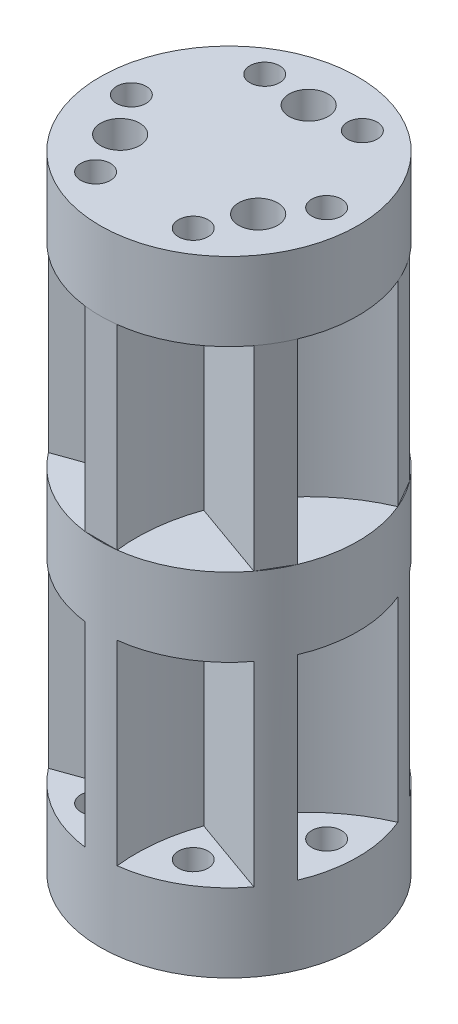
from build123d import *
from build123d.topology import SkipClean

# Parameters (mm, degrees)
SKETCH_1_R               = 16.5
EXTRUDE_1_DEPTH          = 10
CUT_EXTRUDE_1_DEPTH      = 26.38700455
CUT_EXTRUDE_1_DEPTH_BACK = 26.38700455
SKETCH_4_R               = 2.5
SKETCH_4_R_2             = 1.9
EXTRUDE_2_DEPTH          = 25
SKETCH_7_R               = 16.5
EXTRUDE_3_DEPTH          = 5
EXTRUDE_4_DEPTH          = 25
SKETCH_10_R              = 16.5
EXTRUDE_5_DEPTH          = 10
SKETCH_11_R              = 1.9
SKETCH_11_R_2            = 2.5
CUT_EXTRUDE_3_DEPTH      = 10


with BuildPart() as part:
    # 草图1 → 凸台-拉伸1 (new body)
    with BuildSketch(Plane(origin=(0, 0, 0), x_dir=(1, 0, 0), z_dir=(0, 1, 0))):
        with Locations(Location((0, 0, 0), (0, 0, 270))):
            Circle(SKETCH_1_R)
    extrude(amount=EXTRUDE_1_DEPTH)

    # 草图4 → 切除-拉伸1 (cut, two sides: drawn at the far end of the back side and taken through both)
    with BuildSketch(Plane(origin=(0, 10, 0), x_dir=(1, 0, 0), z_dir=(0, 1, 0)).offset(-CUT_EXTRUDE_1_DEPTH_BACK)):
        with Locations(Location((0, 10.2, 0), (0, 0, 270))):
            Circle(SKETCH_4_R)
        with Locations(Location((-6.25, 10.825317547, 0), (0, 0, 270))):
            Circle(SKETCH_4_R_2)
        with Locations(Location((6.25, 10.825317547, 0), (0, 0, 270))):
            Circle(SKETCH_4_R_2)
        with Locations(Location((12.5, 0, 0), (0, 0, 270))):
            Circle(SKETCH_4_R_2)
        with Locations(Location((6.25, -10.825317547, 0), (0, 0, 270))):
            Circle(SKETCH_4_R_2)
        with Locations(Location((-6.25, -10.825317547, 0), (0, 0, 270))):
            Circle(SKETCH_4_R_2)
        with Locations(Location((-12.5, 0, 0), (0, 0, 270))):
            Circle(SKETCH_4_R_2)
        with Locations(Location((8.833459119, -5.1, 0), (0, 0, 270))):
            Circle(SKETCH_4_R)
        with Locations(Location((-8.833459119, -5.1, 0), (0, 0, 270))):
            Circle(SKETCH_4_R)
    extrude(amount=CUT_EXTRUDE_1_DEPTH + CUT_EXTRUDE_1_DEPTH_BACK, mode=Mode.SUBTRACT)

    # 草图6 → 凸台-拉伸2 (add)
    with SkipClean():  # the faces are left unmerged after this step: merging them gives an invalid solid
        with BuildSketch(Plane(origin=(0, 10, 0), x_dir=(1, 0, 0), z_dir=(0, 1, 0))):
            with BuildLine():
                Line((-15.206199095, -6.404803594), (-7.145587151, 0.449076957))
                ThreePointArc((-7.145587151, 0.449076957), (-10.83223207, 3.892058734), (-15.206199095, 6.404803594))
                ThreePointArc((-15.206199095, 6.404803594), (-14.289419162, 8.25), (-13.149822167, 9.966552914))
                ThreePointArc((-13.149822167, 9.966552914), (-8.786737771, 7.434958785), (-3.961705629, 5.96372152))
                Line((-3.961705629, 5.96372152), (-2.056376928, 16.371356508))
                ThreePointArc((-2.056376928, 16.371356508), (0, 16.5), (2.056376928, 16.371356508))
                Line((2.056376928, 16.371356508), (3.961705629, 5.96372152))
                ThreePointArc((3.961705629, 5.96372152), (8.786737771, 7.434958785), (13.149822167, 9.966552914))
                ThreePointArc((13.149822167, 9.966552914), (14.289419162, 8.25), (15.206199095, 6.404803594))
                ThreePointArc((15.206199095, 6.404803594), (10.83223207, 3.892058734), (7.145587151, 0.449076957))
                Line((7.145587151, 0.449076957), (15.206199095, -6.404803594))
                ThreePointArc((15.206199095, -6.404803594), (14.289419162, -8.25), (13.149822167, -9.966552914))
                Line((13.149822167, -9.966552914), (3.183881523, -6.412798476))
                ThreePointArc((3.183881523, -6.412798476), (2.045494299, -11.327017519), (2.056376928, -16.371356508))
                ThreePointArc((2.056376928, -16.371356508), (0, -16.5), (-2.056376928, -16.371356508))
                ThreePointArc((-2.056376928, -16.371356508), (-2.045494299, -11.327017519), (-3.183881523, -6.412798476))
                Line((-3.183881523, -6.412798476), (-13.149822167, -9.966552914))
                ThreePointArc((-13.149822167, -9.966552914), (-14.289419162, -8.25), (-15.206199095, -6.404803594))
            make_face()
        extrude(amount=EXTRUDE_2_DEPTH)

    # 草图7 → 凸台-拉伸3 (add)
    with SkipClean():  # the faces are left unmerged after this step: merging them gives an invalid solid
        with BuildSketch(Plane(origin=(0, 35, 0), x_dir=(1, 0, 0), z_dir=(0, 1, 0))):
            with Locations(Location((0, 0, 0), (0, 0, 270))):
                Circle(SKETCH_7_R)
        extrude_3 = extrude(amount=EXTRUDE_3_DEPTH)

    # 镜向3: 凸台-拉伸3 across plane
    with SkipClean():  # the faces are left unmerged after this step: merging them gives an invalid solid
        add(extrude_3.mirror(Plane.ZX.offset(40)))

    # 草图9 → 凸台-拉伸4 (add)
    with SkipClean():  # the faces are left unmerged after this step: merging them gives an invalid solid
        with BuildSketch(Plane(origin=(0, 45, 0), x_dir=(1, 0, 0), z_dir=(0, 1, 0))):
            with BuildLine():
                Line((-13.149822167, -9.966552914), (-3.183881523, -6.412798476))
                ThreePointArc((-3.183881523, -6.412798476), (-2.045494299, -11.327017519), (-2.056376928, -16.371356508))
                Line((-2.056376928, -16.371356508), (2.056376928, -16.371356508))
                ThreePointArc((2.056376928, -16.371356508), (2.045494299, -11.327017519), (3.183881523, -6.412798476))
                Line((3.183881523, -6.412798476), (13.149822167, -9.966552914))
                Line((13.149822167, -9.966552914), (15.206199095, -6.404803594))
                Line((15.206199095, -6.404803594), (7.145587151, 0.449076957))
                ThreePointArc((7.145587151, 0.449076957), (10.83223207, 3.892058734), (15.206199095, 6.404803594))
                Line((15.206199095, 6.404803594), (13.149822167, 9.966552914))
                ThreePointArc((13.149822167, 9.966552914), (8.786737771, 7.434958785), (3.961705629, 5.96372152))
                Line((3.961705629, 5.96372152), (2.056376928, 16.371356508))
                Line((2.056376928, 16.371356508), (-2.056376928, 16.371356508))
                Line((-2.056376928, 16.371356508), (-3.961705629, 5.96372152))
                ThreePointArc((-3.961705629, 5.96372152), (-8.786737771, 7.434958785), (-13.149822167, 9.966552914))
                Line((-13.149822167, 9.966552914), (-15.206199095, 6.404803594))
                ThreePointArc((-15.206199095, 6.404803594), (-10.83223207, 3.892058734), (-7.145587151, 0.449076957))
                Line((-7.145587151, 0.449076957), (-15.206199095, -6.404803594))
                Line((-15.206199095, -6.404803594), (-13.149822167, -9.966552914))
            make_face()
        extrude(amount=EXTRUDE_4_DEPTH)

    # 草图10 → 凸台-拉伸5 (add)
    with SkipClean():  # the faces are left unmerged after this step: merging them gives an invalid solid
        with BuildSketch(Plane(origin=(0, 70, 0), x_dir=(1, 0, 0), z_dir=(0, 1, 0))):
            with Locations(Location((0, 0, 0), (0, 0, 97.159326011))):
                Circle(SKETCH_10_R)
        extrude(amount=EXTRUDE_5_DEPTH)

    # 草图11 → 切除-拉伸3 (cut)
    with SkipClean():  # the faces are left unmerged after this step: merging them gives an invalid solid
        with BuildSketch(Plane(origin=(0, 80, 0), x_dir=(1, 0, 0), z_dir=(0, 1, 0))):
            with Locations(Location((12.5, 0, 0), (0, 0, 270))):
                Circle(SKETCH_11_R)
            with Locations(Location((8.833459119, -5.1, 0), (0, 0, 270))):
                Circle(SKETCH_11_R_2)
            with Locations(Location((6.25, -10.825317547, 0), (0, 0, 270))):
                Circle(SKETCH_11_R)
            with Locations(Location((-6.25, -10.825317547, 0), (0, 0, 270))):
                Circle(SKETCH_11_R)
            with Locations(Location((-8.833459119, -5.1, 0), (0, 0, 270))):
                Circle(SKETCH_11_R_2)
            with Locations(Location((-12.5, 0, 0), (0, 0, 270))):
                Circle(SKETCH_11_R)
            with Locations(Location((-6.25, 10.825317547, 0), (0, 0, 270))):
                Circle(SKETCH_11_R)
            with Locations(Location((0, 10.2, 0), (0, 0, 270))):
                Circle(SKETCH_11_R_2)
            with Locations(Location((6.25, 10.825317547, 0), (0, 0, 270))):
                Circle(SKETCH_11_R)
        extrude(amount=-CUT_EXTRUDE_3_DEPTH, mode=Mode.SUBTRACT)


solid = part.part
